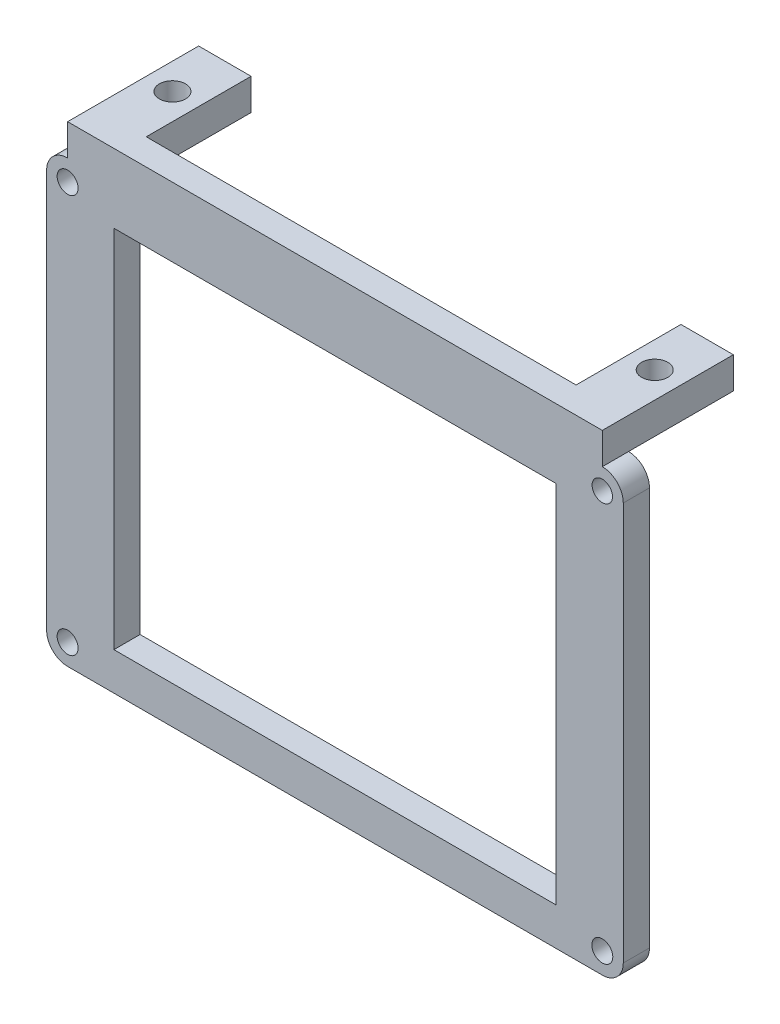
from build123d import *

# Parameters (mm, degrees)
SKETCH_1_R          = 1.945914192
SKETCH_1_R_2        = 2
EXTRUDE_1_DEPTH     = 5
SKETCH_2_W          = 10
SKETCH_2_H          = 20
SKETCH_2_R          = 2.5
SKETCH_2_H_2        = 5
SKETCH_2_W_2        = 82
EXTRUDE_2_DEPTH     = 6
SKETCH_3_W          = 84.346489647
SKETCH_3_H          = 69.622064444
CUT_EXTRUDE_1_DEPTH = 6


with BuildPart() as part:
    # 草图1 → 凸台-拉伸1 (new body)
    with BuildSketch(Plane.XY):
        with BuildLine():
            Line((-34.088642659, 27.271468144), (67.911357341, 27.271468144))
            ThreePointArc((67.911357341, 27.271468144), (70.739784465, 26.099895269), (71.911357341, 23.271468144))
            Line((71.911357341, 23.271468144), (71.911357341, -52.728531856))
            ThreePointArc((71.911357341, -52.728531856), (70.739784465, -55.556958981), (67.911357341, -56.728531856))
            Line((67.911357341, -56.728531856), (-34.088642659, -56.728531856))
            ThreePointArc((-34.088642659, -56.728531856), (-36.917069784, -55.556958981), (-38.088642659, -52.728531856))
            Line((-38.088642659, -52.728531856), (-38.088642659, 23.271468144))
            ThreePointArc((-38.088642659, 23.271468144), (-36.917069784, 26.099895269), (-34.088642659, 27.271468144))
        make_face()
        with Locations((67.911357341, 23.271468144)):
            Circle(SKETCH_1_R, mode=Mode.SUBTRACT)
        with Locations((-34.088642659, 23.271468144)):
            Circle(SKETCH_1_R_2, mode=Mode.SUBTRACT)
        with Locations((67.911357341, -52.728531856)):
            Circle(SKETCH_1_R_2, mode=Mode.SUBTRACT)
        with Locations((-34.088642659, -52.728531856)):
            Circle(SKETCH_1_R_2, mode=Mode.SUBTRACT)
    extrude(amount=EXTRUDE_1_DEPTH)

    # 草图2 → 凸台-拉伸2 (add)
    # profile 1 of 5: a face of its own
    with BuildSketch(Plane(origin=(0, 27.271468144, 0), x_dir=(1, 0, 0), z_dir=(0, 1, 0))):
        with Locations((-29.088642659, 10)):
            Rectangle(SKETCH_2_W, SKETCH_2_H)
        with Locations(Location((-29.088642659, 10, 0), (0, 0, 270))):
            Circle(SKETCH_2_R, mode=Mode.SUBTRACT)
    # profile 2 of 5: a face of its own
    with BuildSketch(Plane(origin=(0, 27.271468144, 0), x_dir=(1, 0, 0), z_dir=(0, 1, 0))):
        with Locations((-29.088642659, -2.5)):
            Rectangle(SKETCH_2_W, SKETCH_2_H_2)
    # profile 3 of 5: a face of its own
    with BuildSketch(Plane(origin=(0, 27.271468144, 0), x_dir=(1, 0, 0), z_dir=(0, 1, 0))):
        with Locations((16.911357341, -2.5)):
            Rectangle(SKETCH_2_W_2, SKETCH_2_H_2)
    # profile 4 of 5: a face of its own
    with BuildSketch(Plane(origin=(0, 27.271468144, 0), x_dir=(1, 0, 0), z_dir=(0, 1, 0))):
        with Locations((62.911357341, 10)):
            Rectangle(SKETCH_2_W, SKETCH_2_H)
        with Locations(Location((62.911357341, 10, 0), (0, 0, 270))):
            Circle(SKETCH_2_R, mode=Mode.SUBTRACT)
    # profile 5 of 5: a face of its own
    with BuildSketch(Plane(origin=(0, 27.271468144, 0), x_dir=(1, 0, 0), z_dir=(0, 1, 0))):
        with Locations((62.911357341, -2.5)):
            Rectangle(SKETCH_2_W, SKETCH_2_H_2)
    extrude(amount=EXTRUDE_2_DEPTH)

    # 草图3 → 切除-拉伸1 (cut)
    with BuildSketch(Plane.XY.offset(5)):
        with Locations((16.911357341, -14.728531856)):
            Rectangle(SKETCH_3_W, SKETCH_3_H)
    extrude(amount=-CUT_EXTRUDE_1_DEPTH, mode=Mode.SUBTRACT)


solid = part.part
